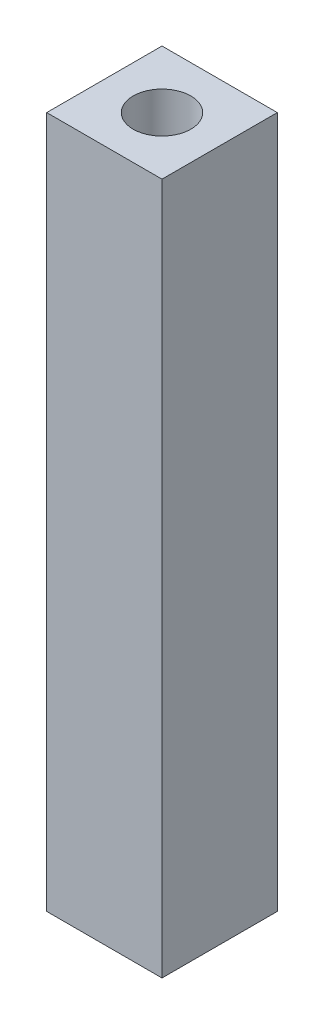
from build123d import *

# Parameters (mm, degrees)
SKETCH1_W           = 10
SKETCH1_H           = 10
BOSS_EXTRUDE1_DEPTH = 60
SKETCH2_R           = 2.5
CUT_EXTRUDE1_DEPTH  = 61.415229868


with BuildPart() as part:
    # Sketch1 → Boss-Extrude1 (new body)
    with BuildSketch(Plane(origin=(0, 0, 0), x_dir=(1, 0, 0), z_dir=(0, 1, 0))):
        Rectangle(SKETCH1_W, SKETCH1_H)
    extrude(amount=BOSS_EXTRUDE1_DEPTH)

    # Sketch2 → Cut-Extrude1 (cut, through all)
    with BuildSketch(Plane(origin=(0, 60, 0), x_dir=(1, 0, 0), z_dir=(0, 1, 0))):
        with Locations(Location((0, 0, 0), (0, 0, 270))):
            Circle(SKETCH2_R)
    extrude(amount=-CUT_EXTRUDE1_DEPTH, mode=Mode.SUBTRACT)


solid = part.part
